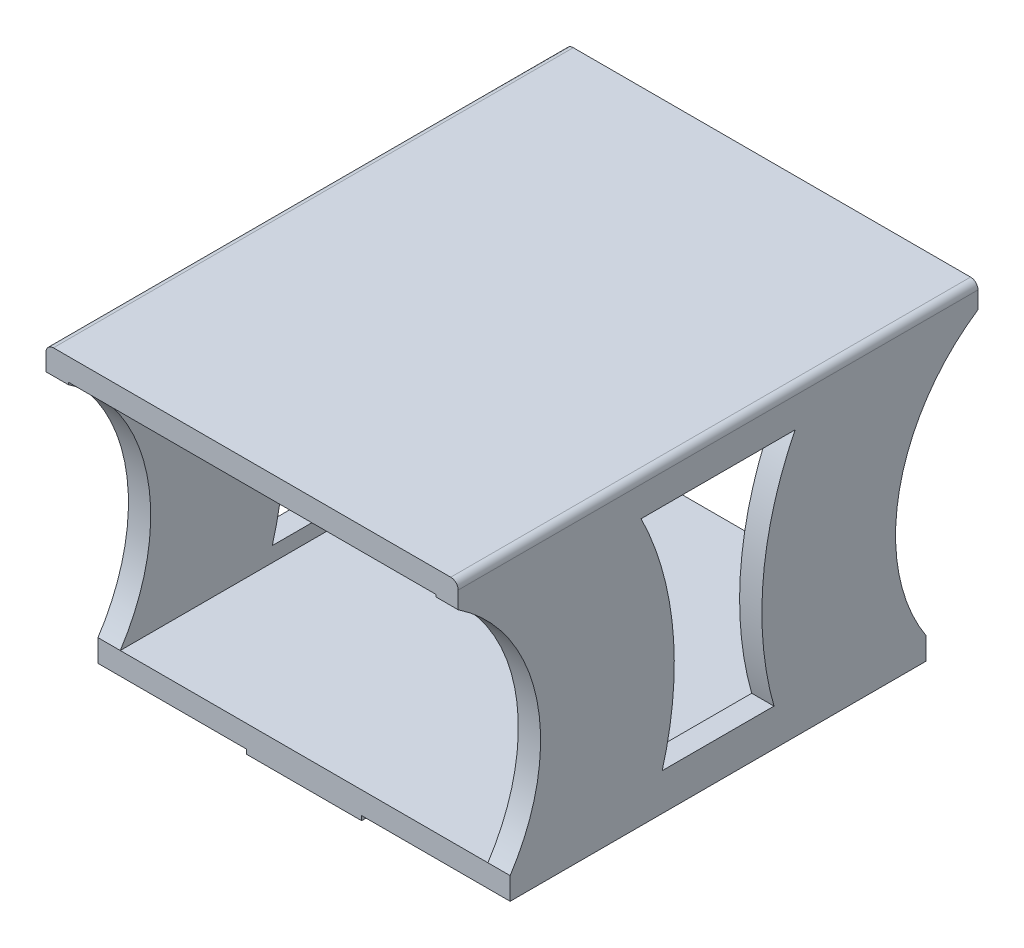
from build123d import *

# Parameters (mm, degrees)
SKETCH1_W               = 55.5
SKETCH1_H               = 56
BOSS_EXTRUDE1_DEPTH     = 3
BOSS_EXTRUDE2_DEPTH     = 28
BOSS_EXTRUDE3_DEPTH     = 35
CUT_EXTRUDE3_DEPTH      = 61.495475037
CUT_EXTRUDE3_DEPTH_BACK = 61.495475037
SKETCH6_W               = 15.5
SKETCH6_H               = 56
BOSS_EXTRUDE4_DEPTH     = 0.6
SKETCH7_R               = 7.1
BOSS_EXTRUDE5_DEPTH     = 1.7
FILLET2_R               = 1


with BuildPart() as part:
    # Sketch1 → Boss-Extrude1 (new body)
    with BuildSketch(Plane(origin=(0, 0, 0), x_dir=(1, 0, 0), z_dir=(0, 1, 0))):
        Rectangle(SKETCH1_W, SKETCH1_H)
    extrude(amount=BOSS_EXTRUDE1_DEPTH)

    # Sketch3 → Boss-Extrude2 (add, symmetric)
    with BuildSketch(Plane.XY):
        Polygon((-27.75, 3), (-27.75, 40.8), (27.75, 40.8), (27.75, 3), (24.75, 3), (24.75, 37.8), (-24.75, 37.8), (-24.75, 3), align=None)
    extrude(amount=BOSS_EXTRUDE2_DEPTH, both=True)

    # Sketch4 → Boss-Extrude3 (add, symmetric)
    with BuildSketch(Plane.XY):
        Polygon((27.75, 40.8), (-27.75, 40.8), (-27.75, 37.5), (-27.75, 3), (-24.75, 3), (-24.75, 37.8), (24.75, 37.8), (24.75, 3), (27.75, 3), (27.75, 37.5), align=None)
    extrude(amount=BOSS_EXTRUDE3_DEPTH, both=True)

    # Sketch5 → Cut-Extrude3 (cut, two sides: drawn at the far end of the back side and taken through both)
    with BuildSketch(Plane(origin=(0, 0, 0), x_dir=(0, 0, -1), z_dir=(1, 0, 0)).offset(-CUT_EXTRUDE3_DEPTH_BACK)):
        with BuildLine():
            Line((-10.364011889, 35.8), (10.364011889, 35.8))
            ThreePointArc((10.364011889, 35.8), (6.080263232, 20.66392266), (7.526937591, 5))
            Line((7.526937591, 5), (-7.526937591, 5))
            ThreePointArc((-7.526937591, 5), (-6.080263232, 20.66392266), (-10.364011889, 35.8))
        make_face()
        with BuildLine():
            Line((-35, 37.5), (-35, 3))
            Line((-35, 3), (-28, 3))
            ThreePointArc((-28, 3), (-24.398228699, 21.690939105), (-35, 37.5))
        make_face()
        with BuildLine():
            Line((28, 3), (35, 3))
            Line((35, 3), (35, 37.5))
            ThreePointArc((35, 37.5), (24.398228699, 21.690939105), (28, 3))
        make_face()
    extrude(amount=CUT_EXTRUDE3_DEPTH + CUT_EXTRUDE3_DEPTH_BACK, mode=Mode.SUBTRACT)

    # Sketch6 → Boss-Extrude4 (add)
    with BuildSketch(Plane.XZ):
        Rectangle(SKETCH6_W, SKETCH6_H)
    extrude(amount=BOSS_EXTRUDE4_DEPTH)

    # Sketch7 → Boss-Extrude5 (add)
    with BuildSketch(Plane.XZ.offset(0.6)):
        with Locations(Location((0, 0, 0), (0, 0, 270))):
            Circle(SKETCH7_R)
    extrude(amount=BOSS_EXTRUDE5_DEPTH)

    # Fillet2
    fillet2_edges = [part.edges().sort_by_distance(p)[0] for p in [
        (27.75, 40.8, 0),
        (-27.75, 40.8, 0),
    ]]
    fillet(fillet2_edges, radius=FILLET2_R)


solid = part.part
